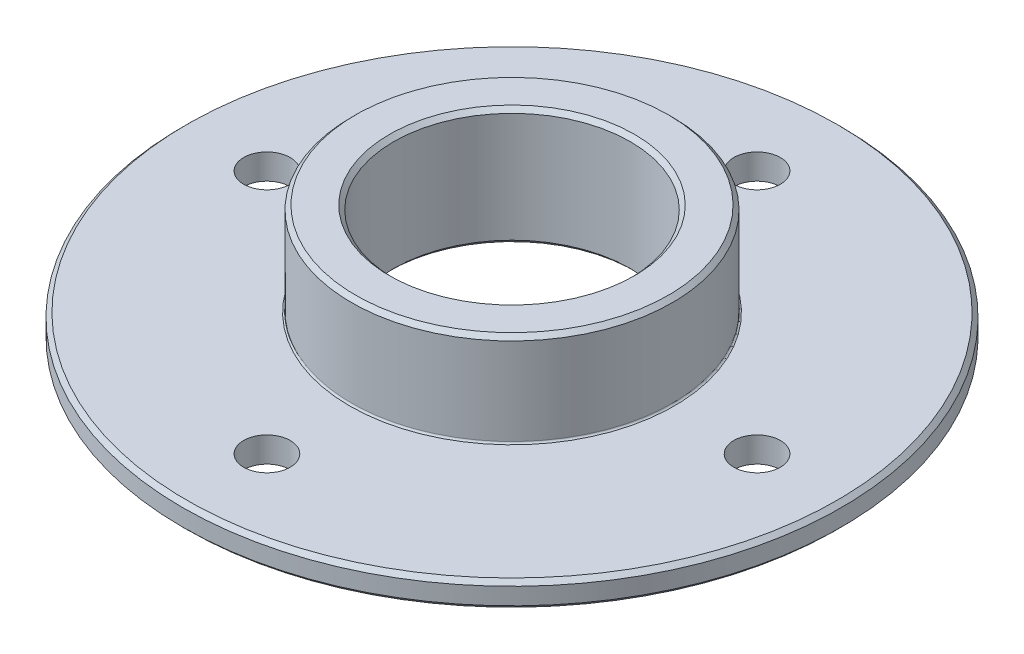
from build123d import *

# Parameters (mm, degrees)
M5_CLEARANCE_HOLE1_D = 5.5
FILLET1_R            = 0.2
CHAMFER1_SIZE        = 0.5
SKETCH7_R            = 14
CUT_EXTRUDE2_DEPTH   = 57.903426962
CHAMFER2_SIZE        = 0.5


with BuildPart() as part:
    # Sketch1 → Revolve1 (revolve)
    with BuildSketch(Plane.XY, mode=Mode.PRIVATE) as revolve1_sk:
        Polygon((14, -3), (14, 8), (12, 8), (12, 11), (19, 11), (19, 0), (39, 0), (39, -3), align=None)
    revolve(revolve1_sk.sketch.rotate(Axis((0, 17.954019247, 0), (0, -1, 0)), 90), axis=Axis((0, 17.954019247, 0), (0, -1, 0)))

    # M5 Clearance Hole1 (through all)
    with Locations(Plane(origin=(0, 0, 0), x_dir=(1, 0, 0), z_dir=(0, 1, 0))):
        with Locations((0, 29), (29, 0), (0, -29), (-29, 0)):
            Hole(M5_CLEARANCE_HOLE1_D / 2)

    # Fillet1
    fillet1_edges = [part.edges().sort_by_distance(p)[0] for p in [
        (0, 0, -19),
        (0, 8, -14),
    ]]
    fillet(fillet1_edges, radius=FILLET1_R)

    # Chamfer1
    chamfer1_edges = [part.edges().sort_by_distance(p)[0] for p in [
        (0, 8, -12),
        (0, 11, -12),
        (0, 11, -19),
        (0, 0, -39),
        (0, -3, -39),
        (0, -3, -14),
    ]]
    chamfer(chamfer1_edges, length=CHAMFER1_SIZE)

    # Sketch7 → Cut-Extrude2 (cut, through all)
    with BuildSketch(Plane.XZ.offset(3)):
        with Locations(Location((0, 0, 0), (0, 0, 90))):
            Circle(SKETCH7_R)
    extrude(amount=-CUT_EXTRUDE2_DEPTH, mode=Mode.SUBTRACT)

    # Chamfer2
    chamfer2_edges = [part.edges().sort_by_distance(p)[0] for p in [
        (0, 11, -14),
    ]]
    chamfer(chamfer2_edges, length=CHAMFER2_SIZE)


solid = part.part
